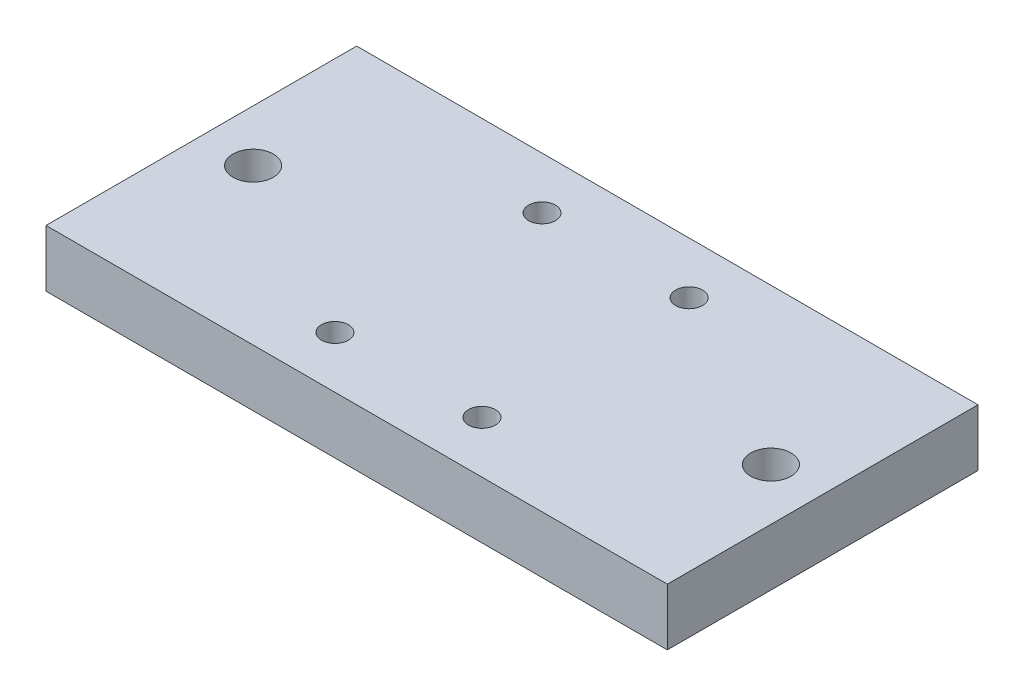
from build123d import *

# Parameters (mm, degrees)
SKETCH_1_W          = 600
SKETCH_1_H          = 300
EXTRUDE_1_DEPTH     = 55
SKETCH_2_R          = 19.5
SKETCH_2_R_2        = 13
CUT_EXTRUDE_1_DEPTH = 674.071318658


with BuildPart() as part:
    # 草图1 → 凸台-拉伸1 (new body)
    with BuildSketch(Plane(origin=(0, 0, 0), x_dir=(1, 0, 0), z_dir=(0, 1, 0))):
        with Locations((300, 150)):
            Rectangle(SKETCH_1_W, SKETCH_1_H)
    extrude(amount=EXTRUDE_1_DEPTH)

    # 草图2 → 切除-拉伸1 (cut, through all)
    with BuildSketch(Plane(origin=(0, 55, 0), x_dir=(1, 0, 0), z_dir=(0, 1, 0))):
        with Locations(Location((50, 150, 0), (0, 0, 270))):
            Circle(SKETCH_2_R)
        with Locations(Location((550, 150, 0), (0, 0, 270))):
            Circle(SKETCH_2_R)
        with Locations(Location((371, 250, 0), (0, 0, 270))):
            Circle(SKETCH_2_R_2)
        with Locations(Location((229, 250, 0), (0, 0, 270))):
            Circle(SKETCH_2_R_2)
        with Locations(Location((371, 50, 0), (0, 0, 270))):
            Circle(SKETCH_2_R_2)
        with Locations(Location((229, 50, 0), (0, 0, 270))):
            Circle(SKETCH_2_R_2)
    extrude(amount=-CUT_EXTRUDE_1_DEPTH, mode=Mode.SUBTRACT)


solid = part.part
